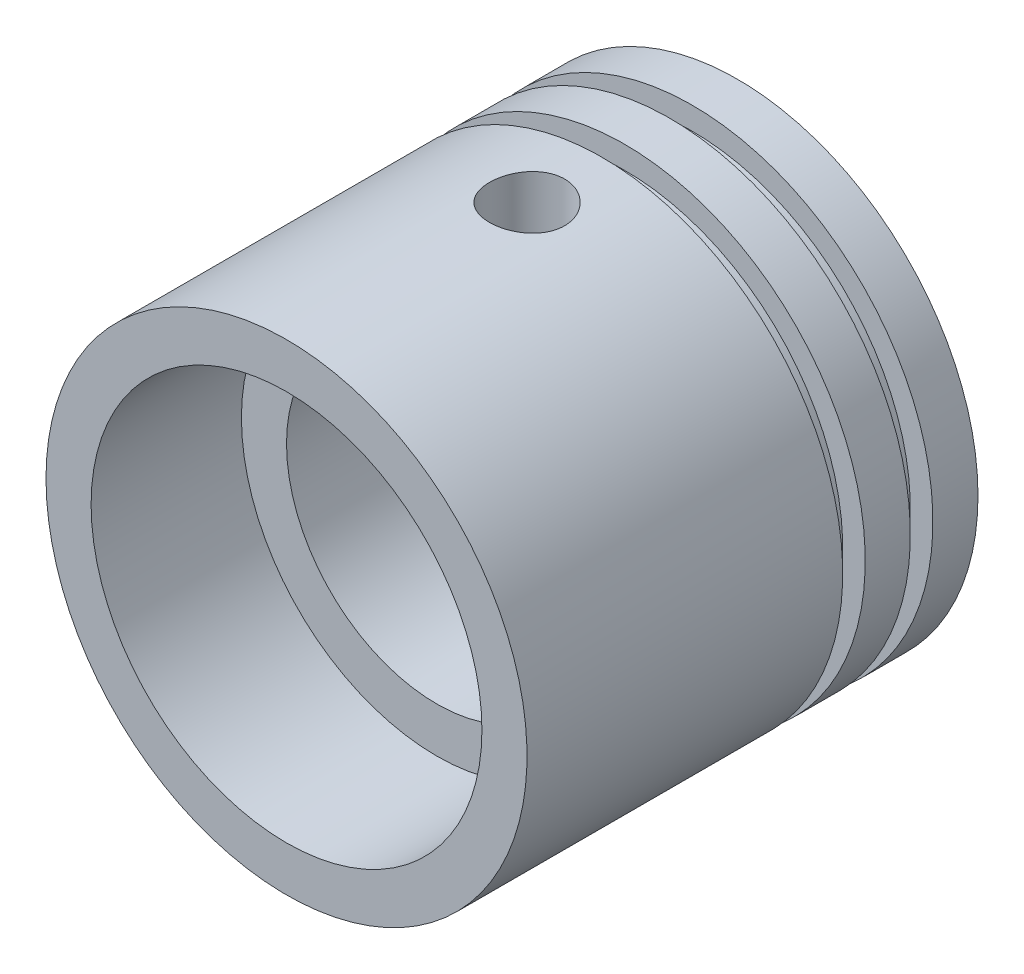
from build123d import *

# Parameters (mm, degrees)
SKETCH3_R          = 2.5
CUT_EXTRUDE1_DEPTH = 40


with BuildPart() as part:
    # Sketch1 → Revolve1 (revolve)
    with BuildSketch(Plane(origin=(0, 0, 0), x_dir=(1, 0, 0), z_dir=(0, 1, 0)), mode=Mode.PRIVATE) as revolve1_sk:
        with BuildLine():
            Line((16, -2.512699454), (3.472963553, -0.30384494))
            ThreePointArc((3.472963553, -0.30384494), (1.743114855, -0.076106038), (0, 0))
            Line((0, 0), (0, -8.512699454))
            Line((0, -8.512699454), (10, -8.512699454))
            Line((10, -8.512699454), (10, -22.512699454))
            Line((10, -22.512699454), (13, -22.512699454))
            Line((13, -22.512699454), (13, -32.512699454))
            Line((13, -32.512699454), (16, -32.512699454))
            Line((16, -32.512699454), (16, -11.512699454))
            Line((16, -11.512699454), (14.5, -11.512699454))
            Line((14.5, -11.512699454), (14.5, -10.012699454))
            Line((14.5, -10.012699454), (16, -10.012699454))
            Line((16, -10.012699454), (16, -7.012699454))
            Line((16, -7.012699454), (14.5, -7.012699454))
            Line((14.5, -7.012699454), (14.5, -5.512699454))
            Line((14.5, -5.512699454), (16, -5.512699454))
            Line((16, -5.512699454), (16, -2.512699454))
        make_face()
    revolve(revolve1_sk.sketch.rotate(Axis((0, 0, 0), (0, 0, 1)), 180), axis=Axis((0, 0, 0), (0, 0, 1)))

    # Sketch3 → Cut-Extrude1 (cut, symmetric)
    with BuildSketch(Plane(origin=(0, 0, 0), x_dir=(0, 0, -1), z_dir=(0, 1, 0))):
        with Locations(Location((-16.512699454, 0, 0), (0, 0, 180))):
            Circle(SKETCH3_R)
    extrude(amount=CUT_EXTRUDE1_DEPTH, both=True, mode=Mode.SUBTRACT)


solid = part.part
